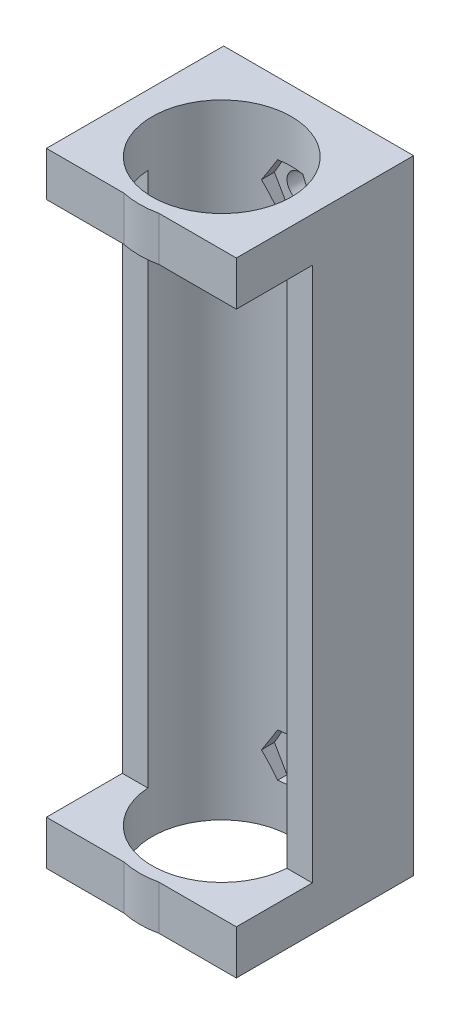
from build123d import *

# Parameters (mm, degrees)
SKETCH2_R           = 13
SKETCH2_R_2         = 11
BOSS_EXTRUDE3_DEPTH = 98.5
CUT_EXTRUDE2_START  = 7
SKETCH2_2_R         = 13
SKETCH2_2_R_2       = 11
CUT_EXTRUDE2_DEPTH  = 84.5
SKETCH1_W           = 30
SKETCH1_H           = 98.5
SKETCH1_R           = 2
BOSS_EXTRUDE5_DEPTH = 4
SKETCH3_W           = 8.573743233
SKETCH3_H           = 7
SKETCH3_W_2         = 12.852513534
SKETCH3_W_3         = 30
BOSS_EXTRUDE8_DEPTH = 24
SKETCH4_W           = 30
SKETCH4_H           = 12
BOSS_EXTRUDE9_DEPTH = 84.5
SKETCH2_3_R         = 11
CUT_EXTRUDE3_DEPTH  = 360.900226616
CUT_EXTRUDE4_START  = 3
SKETCH1_6_R         = 2
CUT_EXTRUDE4_DEPTH  = 10
SKETCH1_7_R         = 2
CUT_EXTRUDE5_DEPTH  = 427.557716632


with BuildPart() as part:
    # Sketch2 → Boss-Extrude3 (new body)
    with BuildSketch(Plane.XZ.offset(150.75)):
        with Locations(Location((-330, 15.300585116, 0), (0, 0, 180))):
            Circle(SKETCH2_R)
        with Locations(Location((-330, 15.300585116, 0), (0, 0, 242.228070503))):
            Circle(SKETCH2_R_2, mode=Mode.SUBTRACT)
    extrude(amount=BOSS_EXTRUDE3_DEPTH)

    # Sketch2<2> → Cut-Extrude2 (cut)
    with BuildSketch(Plane.XZ.offset(150.75).offset(CUT_EXTRUDE2_START)):
        with Locations((-330, 15.300585116)):
            Circle(SKETCH2_2_R)
        with Locations((-330, 15.300585116)):
            Circle(SKETCH2_2_R_2, mode=Mode.SUBTRACT)
    extrude(amount=CUT_EXTRUDE2_DEPTH, mode=Mode.SUBTRACT)


with BuildPart() as cut_extrude2_piece_1:
    # of the separate pieces the step leaves, piece 1, a body of its own (cut_extrude2_pieces)
    add(part.part.solids().sort_by_distance((-343, -150.75, 15.300585116))[0])

    # Sketch1 → Boss-Extrude5 (add)
    # profile 1 of 3: a face of its own
    with BuildSketch(Plane.XY):
        with Locations((-330, -200)):
            Rectangle(SKETCH1_W, SKETCH1_H)
        Polygon((-331.991858429, -235.55), (-333.983716857, -239), (-331.991858429, -242.45), (-328.008141571, -242.45), (-326.016283143, -239), (-328.008141571, -235.55), align=None, mode=Mode.SUBTRACT)
        Polygon((-328.008141571, -164.45), (-326.016283143, -161), (-328.008141571, -157.55), (-331.991858429, -157.55), (-333.983716857, -161), (-331.991858429, -164.45), align=None, mode=Mode.SUBTRACT)
    # profile 2 of 3: a face of its own
    with BuildSketch(Plane.XY):
        Polygon((-331.991858429, -164.45), (-328.008141571, -164.45), (-326.016283143, -161), (-328.008141571, -157.55), (-331.991858429, -157.55), (-333.983716857, -161), align=None)
        with Locations((-330, -161)):
            Circle(SKETCH1_R, mode=Mode.SUBTRACT)
    # profile 3 of 3: a face of its own
    with BuildSketch(Plane.XY):
        Polygon((-328.008141571, -235.55), (-331.991858429, -235.55), (-333.983716857, -239), (-331.991858429, -242.45), (-328.008141571, -242.45), (-326.016283143, -239), align=None)
        with Locations((-330, -239)):
            Circle(SKETCH1_R, mode=Mode.SUBTRACT)
    extrude(amount=BOSS_EXTRUDE5_DEPTH)



with BuildPart() as cut_extrude2_piece_2:
    # of the separate pieces the step leaves, piece 2, a body of its own (cut_extrude2_pieces)
    add(part.part.solids().sort_by_distance((-343, -242.25, 15.300585116))[0])


with BuildPart() as cut_extrude2_piece_1_1:
    add(cut_extrude2_piece_1.part)

    add(cut_extrude2_piece_2.part)  # Boss-Extrude8 merges Cut-Extrude2 piece 2
    # Sketch3 → Boss-Extrude8 (add)
    with BuildSketch(Plane.XY.offset(4)):
        with Locations((-340.713128384, -154.25)):
            Rectangle(SKETCH3_W, SKETCH3_H)
        with Locations((-330, -154.25)):
            Rectangle(SKETCH3_W_2, SKETCH3_H)
        with Locations((-330, -245.75)):
            Rectangle(SKETCH3_W_3, SKETCH3_H)
        with Locations((-319.286871616, -154.25)):
            Rectangle(SKETCH3_W, SKETCH3_H)
    extrude(amount=BOSS_EXTRUDE8_DEPTH)

    # Sketch4 → Boss-Extrude9 (add)
    with BuildSketch(Plane.XZ.offset(157.75)):
        with Locations((-330, 10)):
            Rectangle(SKETCH4_W, SKETCH4_H)
    extrude(amount=BOSS_EXTRUDE9_DEPTH)

    # Sketch2<3> → Cut-Extrude3 (cut, through all)
    with BuildSketch(Plane.XZ.offset(150.75)):
        with Locations((-330, 15.300585116)):
            Circle(SKETCH2_3_R)
    extrude(amount=CUT_EXTRUDE3_DEPTH, mode=Mode.SUBTRACT)

    # Sketch1<6> → Cut-Extrude4 (cut)
    # profile 1 of 2: a face of its own
    with BuildSketch(Plane.XY.offset(CUT_EXTRUDE4_START)):
        Polygon((-331.991858429, -164.45), (-328.008141571, -164.45), (-326.016283143, -161), (-328.008141571, -157.55), (-331.991858429, -157.55), (-333.983716857, -161), align=None)
        with Locations((-330, -161)):
            Circle(SKETCH1_6_R, mode=Mode.SUBTRACT)
    # profile 2 of 2: a face of its own
    with BuildSketch(Plane.XY.offset(CUT_EXTRUDE4_START)):
        Polygon((-328.008141571, -235.55), (-331.991858429, -235.55), (-333.983716857, -239), (-331.991858429, -242.45), (-328.008141571, -242.45), (-326.016283143, -239), align=None)
        with Locations((-330, -239)):
            Circle(SKETCH1_6_R, mode=Mode.SUBTRACT)
    extrude(amount=CUT_EXTRUDE4_DEPTH, mode=Mode.SUBTRACT)


with BuildPart() as cut_extrude4_piece_1:
    # of the separate pieces the step leaves, piece 1, a body of its own (cut_extrude4_pieces)
    add(cut_extrude2_piece_1_1.part.solids().sort_by_distance((-315, -249.25, 28))[0])


with BuildPart() as cut_extrude4_piece_2:
    # of the separate pieces the step leaves, piece 2, a body of its own (cut_extrude4_pieces)
    add(cut_extrude2_piece_1_1.part.solids().sort_by_distance((-328, -161, 4.48393129))[0])


with BuildPart() as cut_extrude4_piece_3:
    # of the separate pieces the step leaves, piece 3, a body of its own (cut_extrude4_pieces)
    add(cut_extrude2_piece_1_1.part.solids().sort_by_distance((-328, -239, 4.48393129))[0])


with BuildPart() as cut_extrude5_tool:
    # Sketch1<7> → Cut-Extrude5 (new, through all)
    with BuildSketch(Plane.XY):
        with Locations((-330, -161)):
            Circle(SKETCH1_7_R)
        with Locations((-330, -239)):
            Circle(SKETCH1_7_R)
    extrude(amount=CUT_EXTRUDE5_DEPTH)


with BuildPart() as cut_extrude4_piece_2_1:
    add(cut_extrude4_piece_2.part)

    # Cut-Extrude5: cut by cut_extrude5_tool
    add(cut_extrude5_tool.part, mode=Mode.SUBTRACT)


with BuildPart() as cut_extrude4_piece_3_1:
    add(cut_extrude4_piece_3.part)

    # Cut-Extrude5: cut by cut_extrude5_tool
    add(cut_extrude5_tool.part, mode=Mode.SUBTRACT)


solid = cut_extrude4_piece_1.part
